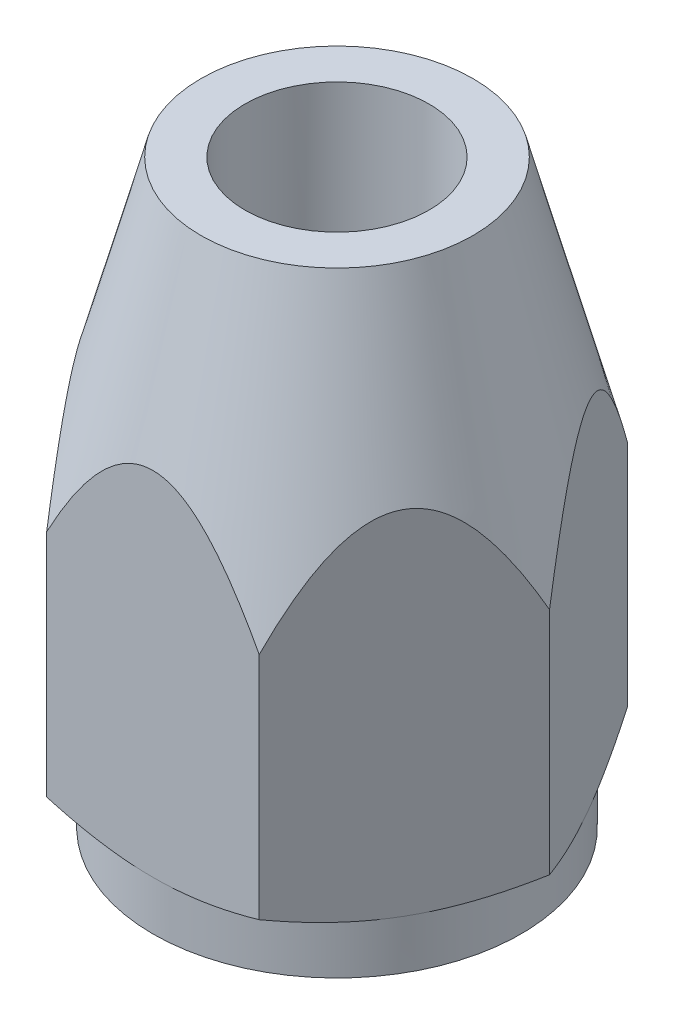
from build123d import *

# Parameters (mm, degrees)
BOSS_EXTRUDE1_DEPTH = 14.2
SKETCH2_R           = 2.25
CUT_EXTRUDE1_DEPTH  = 16.77624797
SKETCH3_R           = 3.95
CUT_EXTRUDE2_DEPTH  = 10
SKETCH4_OUTSIDE_W   = 21.704
SKETCH4_OUTSIDE_H   = 20.312
SKETCH4_OUTSIDE_R   = 3.325
CUT_EXTRUDE3_DEPTH  = 10
CUT_EXTRUDE3_DRAFT  = -15
SKETCH5_OUTSIDE_W   = 16.344
SKETCH5_OUTSIDE_H   = 14.952
SKETCH5_OUTSIDE_R   = 4.5
CUT_EXTRUDE4_DEPTH  = 1.2
SKETCH6_OUTSIDE_W   = 50.986
SKETCH6_OUTSIDE_H   = 49.594
SKETCH6_OUTSIDE_R   = 4.5
CUT_EXTRUDE5_DEPTH  = 10
CUT_EXTRUDE5_DRAFT  = -60


with BuildPart() as part:
    # Sketch1 → Boss-Extrude1 (new body)
    with BuildSketch(Plane(origin=(0, 0, 0), x_dir=(1, 0, 0), z_dir=(0, 1, 0))):
        Polygon((-2.598076211, -4.5), (2.598076211, -4.5), (5.196152423, 0), (2.598076211, 4.5), (-2.598076211, 4.5), (-5.196152423, 0), align=None)
    extrude(amount=BOSS_EXTRUDE1_DEPTH)

    # Sketch2 → Cut-Extrude1 (cut, through all)
    with BuildSketch(Plane(origin=(0, 14.2, 0), x_dir=(1, 0, 0), z_dir=(0, 1, 0))):
        with Locations(Location((0, 0, 0), (0, 0, 270))):
            Circle(SKETCH2_R)
    extrude(amount=-CUT_EXTRUDE1_DEPTH, mode=Mode.SUBTRACT)

    # Sketch3 → Cut-Extrude2 (cut)
    with BuildSketch(Plane.XZ):
        with Locations(Location((0, 0, 0), (0, 0, 270))):
            Circle(SKETCH3_R)
    extrude(amount=-CUT_EXTRUDE2_DEPTH, mode=Mode.SUBTRACT)


with BuildPart() as cut_extrude3_tool:
    # Sketch4 outside → Cut-Extrude3 (with draft: the straight prism first)
    with BuildSketch(Plane(origin=(0, 14.2, 0), x_dir=(1, 0, 0), z_dir=(0, 1, 0))):
        Rectangle(SKETCH4_OUTSIDE_W, SKETCH4_OUTSIDE_H)
        Circle(SKETCH4_OUTSIDE_R, mode=Mode.SUBTRACT)
    extrude(amount=-CUT_EXTRUDE3_DEPTH)
    # Cut-Extrude3: the draft: its side faces are tilted about the plane it starts from
    cut_extrude3_sides = [cut_extrude3_tool.faces().sort_by_distance(p)[0] for p in [
        (0, 9.2, 10.156),
        (10.852, 9.2, 0),
        (0, 9.2, -10.156),
        (-10.852, 9.2, 0),
        (-3.325, 9.2, 0),
    ]]
    draft(cut_extrude3_sides, Plane(origin=(0, 14.2, 0), x_dir=(1, 0, 0), z_dir=(0, 1, 0)), CUT_EXTRUDE3_DRAFT)


with BuildPart() as part_1:
    add(part.part)

    # Cut-Extrude3: cut by cut_extrude3_tool
    add(cut_extrude3_tool.part, mode=Mode.SUBTRACT)

    # Sketch5 outside → Cut-Extrude4 (cut)
    with BuildSketch(Plane.XZ):
        Rectangle(SKETCH5_OUTSIDE_W, SKETCH5_OUTSIDE_H)
        with Locations(Location((0, 0, 0), (0, 0, 90))):
            Circle(SKETCH5_OUTSIDE_R, mode=Mode.SUBTRACT)
    extrude(amount=-CUT_EXTRUDE4_DEPTH, mode=Mode.SUBTRACT)


with BuildPart() as cut_extrude5_tool:
    # Sketch6 outside → Cut-Extrude5 (with draft: the straight prism first)
    with BuildSketch(Plane.XZ.offset(-1.2)):
        Rectangle(SKETCH6_OUTSIDE_W, SKETCH6_OUTSIDE_H)
        with Locations(Location((0, 0, 0), (0, 0, 90))):
            Circle(SKETCH6_OUTSIDE_R, mode=Mode.SUBTRACT)
    extrude(amount=-CUT_EXTRUDE5_DEPTH)
    # Cut-Extrude5: the draft: its side faces are tilted about the plane it starts from
    cut_extrude5_sides = [cut_extrude5_tool.faces().sort_by_distance(p)[0] for p in [
        (0, 6.2, -24.797),
        (25.493, 6.2, 0),
        (0, 6.2, 24.797),
        (-25.493, 6.2, 0),
        (0, 6.2, -4.5),
    ]]
    draft(cut_extrude5_sides, Plane.XZ.offset(-1.2), CUT_EXTRUDE5_DRAFT)


with BuildPart() as part_2:
    add(part_1.part)

    # Cut-Extrude5: cut by cut_extrude5_tool
    add(cut_extrude5_tool.part, mode=Mode.SUBTRACT)


solid = part_2.part
